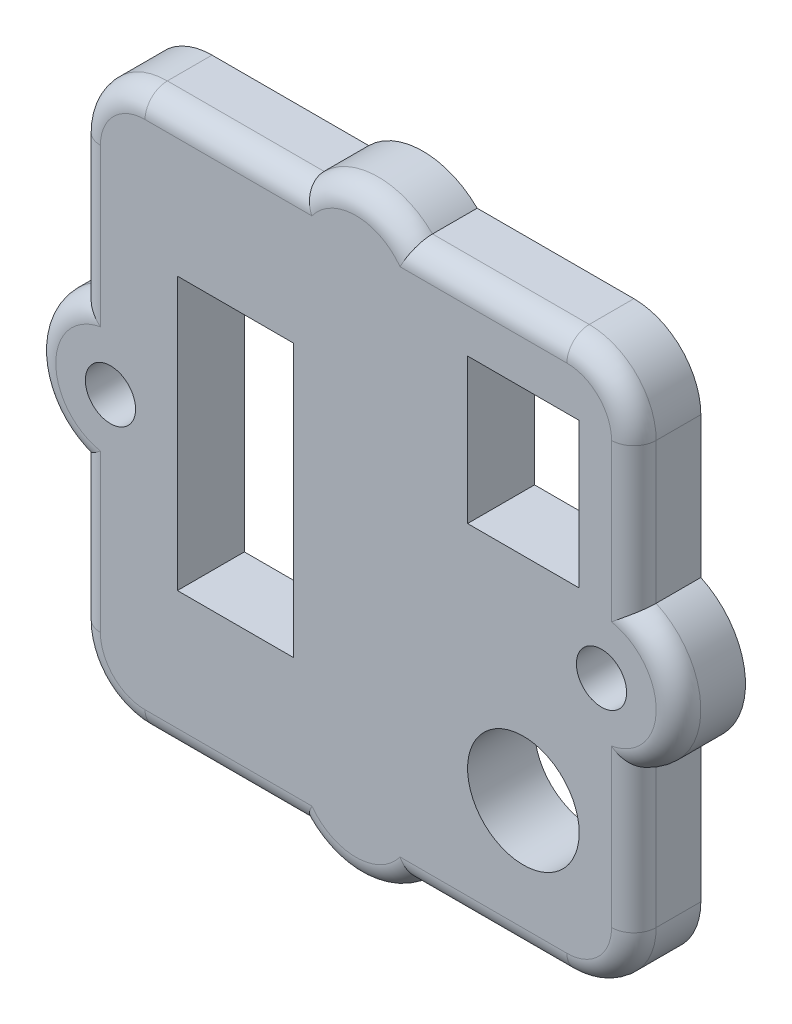
from build123d import *

# Parameters (mm, degrees)
SKETCH1_R           = 1.125
SKETCH1_R_2         = 2.5
SKETCH1_W           = 5.2
SKETCH1_H           = 12.2
SKETCH1_W_2         = 5
SKETCH1_H_2         = 6.5
BOSS_EXTRUDE1_DEPTH = 3
FILLET1_R           = 1


with BuildPart() as part:
    # Sketch1 → Boss-Extrude1 (new body)
    with BuildSketch(Plane.XY):
        with BuildLine():
            Line((23.501825189, 8.05), (23.501825189, 14.369504832))
            ThreePointArc((23.501825189, 14.369504832), (21.501825189, 17.5), (23.501825189, 20.630495168))
            Line((23.501825189, 20.630495168), (23.501825189, 26.95))
            ThreePointArc((23.501825189, 26.95), (24.380504846, 29.071320344), (26.501825189, 29.95))
            Line((26.501825189, 29.95), (33.522833629, 29.95))
            ThreePointArc((33.522833629, 29.95), (35.951825189, 30.95), (38.38081675, 29.95))
            Line((38.38081675, 29.95), (45.401825189, 29.95))
            ThreePointArc((45.401825189, 29.95), (47.523145533, 29.071320344), (48.401825189, 26.95))
            Line((48.401825189, 26.95), (48.401825189, 20.630495168))
            ThreePointArc((48.401825189, 20.630495168), (50.401825189, 17.5), (48.401825189, 14.369504832))
            Line((48.401825189, 14.369504832), (48.401825189, 8.05))
            ThreePointArc((48.401825189, 8.05), (47.523145533, 5.928679656), (45.401825189, 5.05))
            Line((45.401825189, 5.05), (38.38081675, 5.05))
            ThreePointArc((38.38081675, 5.05), (35.951825189, 4.05), (33.522833629, 5.05))
            Line((33.522833629, 5.05), (26.501825189, 5.05))
            ThreePointArc((26.501825189, 5.05), (24.380504846, 5.928679656), (23.501825189, 8.05))
        make_face()
        with Locations((24.951825189, 17.5)):
            Circle(SKETCH1_R, mode=Mode.SUBTRACT)
        with Locations((46.951825189, 17.5)):
            Circle(SKETCH1_R, mode=Mode.SUBTRACT)
        with Locations((43.451825189, 11)):
            Circle(SKETCH1_R_2, mode=Mode.SUBTRACT)
        with Locations((30.551825189, 17.5)):
            Rectangle(SKETCH1_W, SKETCH1_H, mode=Mode.SUBTRACT)
        with Locations((43.451825189, 23.75)):
            Rectangle(SKETCH1_W_2, SKETCH1_H_2, mode=Mode.SUBTRACT)
    extrude(amount=BOSS_EXTRUDE1_DEPTH)

    # Fillet1
    fillet1_edges = [part.edges().sort_by_distance(p)[0] for p in [
        (35.951825189, 4.05, 3),
        (41.891320969, 5.05, 3),
        (47.523145533, 5.928679656, 3),
        (48.401825189, 11.209752416, 3),
        (50.401825189, 17.5, 3),
        (48.401825189, 23.790247584, 3),
        (47.523145533, 29.071320344, 3),
        (41.891320969, 29.95, 3),
        (35.951825189, 30.95, 3),
        (30.012329409, 29.95, 3),
        (24.380504846, 5.928679656, 3),
        (24.380504846, 29.071320344, 3),
        (23.501825189, 23.790247584, 3),
        (21.501825189, 17.5, 3),
        (23.501825189, 11.209752416, 3),
        (30.012329409, 5.05, 3),
    ]]
    fillet(fillet1_edges, radius=FILLET1_R)


solid = part.part
